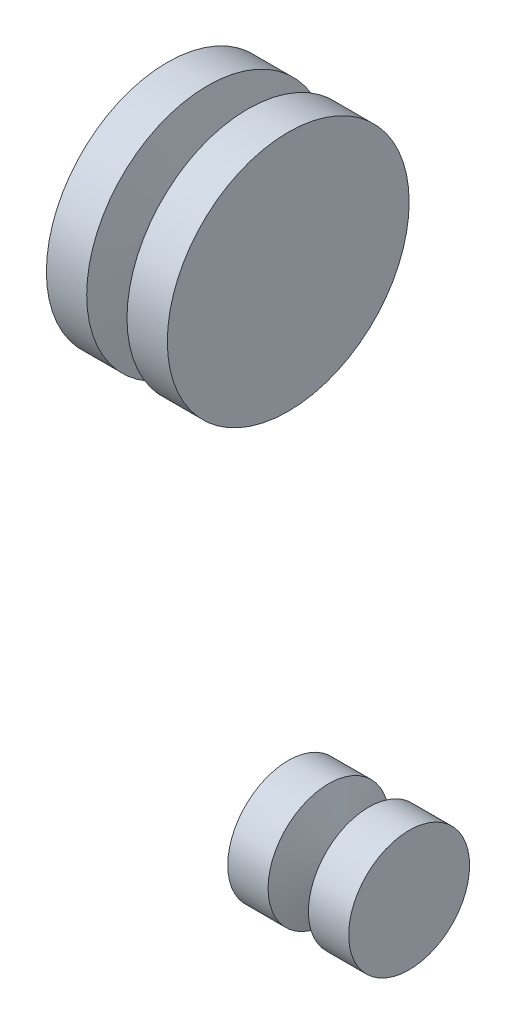
from build123d import *

# Parameters (mm, degrees)
SKETCH1_R             = 10
BOSS_EXTRUDE1_DEPTH   = 5
SKETCH1_R_2           = 5
BOSS_EXTRUDE1_2_DEPTH = 5


with BuildPart() as part:
    # Sketch1 → Boss-Extrude1 (new, symmetric)
    with BuildSketch(Plane(origin=(0, 0, 0), x_dir=(0, 0, -1), z_dir=(1, 0, 0))):
        with Locations((-30, 150)):
            Circle(SKETCH1_R)
    extrude(amount=BOSS_EXTRUDE1_DEPTH, both=True)

    # Sketch3 → Cut-Revolve4 (revolve, cut)
    with BuildSketch(Plane.XY.offset(30), mode=Mode.PRIVATE) as cut_revolve4_sk:
        Polygon((1.666666667, 160), (-1.666666667, 160), (-0.5, 151), (0.5, 151), align=None)
    revolve(cut_revolve4_sk.sketch.rotate(Axis((-5, 150, 30), (1, 0, 0)), 90), axis=Axis((-5, 150, 30), (1, 0, 0)), mode=Mode.SUBTRACT)


with BuildPart() as body_2:
    # Sketch1 → Boss-Extrude1 2 (new, symmetric)
    with BuildSketch(Plane(origin=(0, 0, 0), x_dir=(0, 0, -1), z_dir=(1, 0, 0))):
        with Locations((-20, 100)):
            Circle(SKETCH1_R_2)
    extrude(amount=BOSS_EXTRUDE1_2_DEPTH, both=True)

    # Sketch2 → Cut-Revolve3 (revolve, cut)
    with BuildSketch(Plane.XY.offset(20), mode=Mode.PRIVATE) as cut_revolve3_sk:
        Polygon((0.5, 101), (-0.5, 101), (-1.666666667, 105), (1.666666667, 105), align=None)
    revolve(cut_revolve3_sk.sketch.rotate(Axis((-5, 100, 20), (1, 0, 0)), 90), axis=Axis((-5, 100, 20), (1, 0, 0)), mode=Mode.SUBTRACT)


solid = Compound([part.part, body_2.part])
